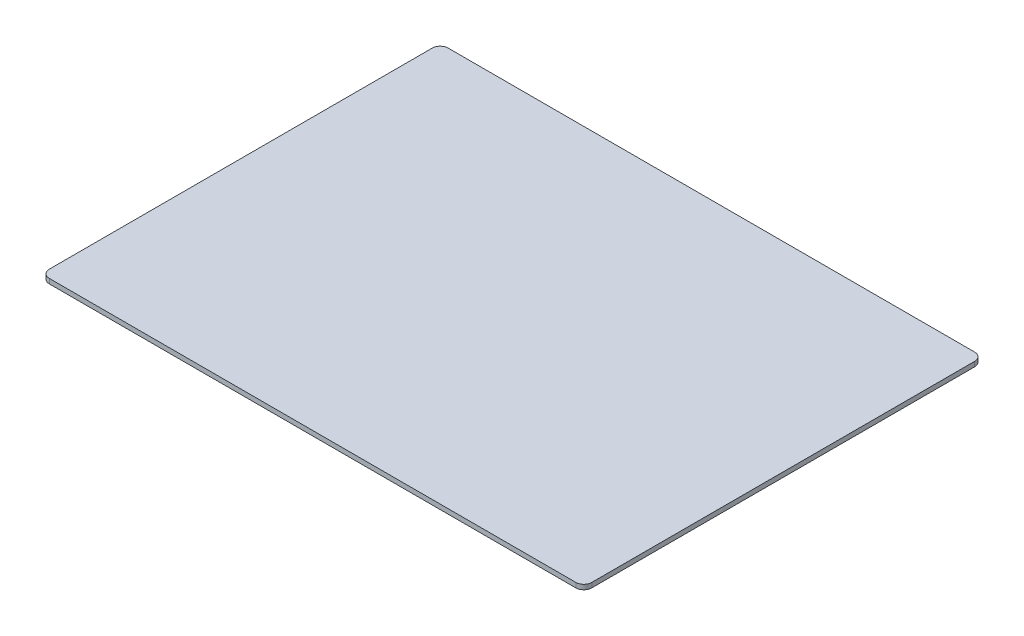
from build123d import *

# Parameters (mm, degrees)
EXTRUDE_1_DEPTH = 3


with BuildPart() as part:
    # 草图2 → 凸台-拉伸1 (new body)
    with BuildSketch(Plane(origin=(0, 0, 0), x_dir=(1, 0, 0), z_dir=(0, 1, 0))):
        with BuildLine():
            Line((-165, 125), (165, 125))
            ThreePointArc((165, 125), (168.535533906, 123.535533906), (170, 120))
            Line((170, 120), (170, -120))
            ThreePointArc((170, -120), (168.535533906, -123.535533906), (165, -125))
            Line((165, -125), (-165, -125))
            ThreePointArc((-165, -125), (-168.535533906, -123.535533906), (-170, -120))
            Line((-170, -120), (-170, 120))
            ThreePointArc((-170, 120), (-168.535533906, 123.535533906), (-165, 125))
        make_face()
    extrude(amount=EXTRUDE_1_DEPTH)


solid = part.part
